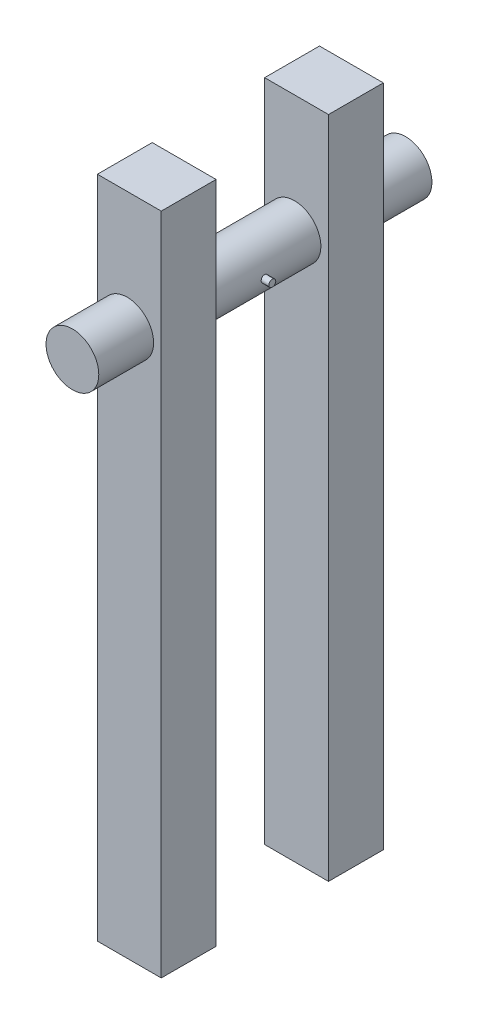
from build123d import *

# Parameters (mm, degrees)
SKETCH1_W                = 7.9
SKETCH1_H                = 95.7
BOSS_EXTRUDE1_DEPTH      = 9.2
SKETCH1_3_W              = 7.9
SKETCH1_3_H              = 95.7
BOSS_EXTRUDE2_DEPTH      = 9.2
BOSS_EXTRUDE3_DEPTH      = 32
BOSS_EXTRUDE3_DEPTH_BACK = 16
SKETCH2_R                = 3.8
BOSS_EXTRUDE4_DEPTH      = 0.0001
BOSS_EXTRUDE4_DEPTH_BACK = 6
SKETCH4_R                = 0.5


with BuildPart() as part:
    # Sketch1 → Boss-Extrude1 (new body)
    with BuildSketch(Plane(origin=(0, 0, 0), x_dir=(0, 0, -1), z_dir=(1, 0, 0))):
        with Locations((-28.171698113, -0.670754717)):
            Rectangle(SKETCH1_W, SKETCH1_H)
    extrude(amount=BOSS_EXTRUDE1_DEPTH)

    # Sketch1<3> → Boss-Extrude2 (add)
    with BuildSketch(Plane(origin=(0, 0, 0), x_dir=(0, 0, -1), z_dir=(1, 0, 0))):
        with Locations((-28.171698113, -0.670754717)):
            Rectangle(SKETCH1_3_W, SKETCH1_3_H)
        with Locations((-4.071698113, -0.670754717)):
            Rectangle(SKETCH1_3_W, SKETCH1_3_H)
    extrude(amount=BOSS_EXTRUDE2_DEPTH)


with BuildPart() as boss_extrude2_piece_1:
    # of the separate pieces the step leaves, piece 1, a body of its own (boss_extrude2_pieces)
    add(part.part.solids().sort_by_distance((0, 47.179245283, 8.021698113))[0])



with BuildPart() as boss_extrude2_piece_2:
    # of the separate pieces the step leaves, piece 2, a body of its own (boss_extrude2_pieces)
    add(part.part.solids().sort_by_distance((0, 47.179245283, 32.121698113))[0])


with BuildPart() as boss_extrude2_piece_1_1:
    add(boss_extrude2_piece_1.part)

    add(boss_extrude2_piece_2.part)  # Boss-Extrude3 merges Boss-Extrude2 piece 2
    # Sketch2 → Boss-Extrude3 (add, two sides: drawn at the far end of the back side and taken through both)
    with BuildSketch(Plane.XY.offset(8.021698113).offset(-BOSS_EXTRUDE3_DEPTH_BACK)):
        with Locations((4.3, 30.179245283)):
            Circle(SKETCH2_R)
    extrude(amount=BOSS_EXTRUDE3_DEPTH + BOSS_EXTRUDE3_DEPTH_BACK)

    # Sketch4 → Boss-Extrude4 (add, two sides: drawn at the far end of the back side and taken through both)
    with BuildSketch(Plane(origin=(9.2, 0, 0), x_dir=(0, 0, -1), z_dir=(1, 0, 0)).offset(-BOSS_EXTRUDE4_DEPTH_BACK)):
        with Locations((-16.121698113, 30.179245283)):
            Circle(SKETCH4_R)
    extrude(amount=BOSS_EXTRUDE4_DEPTH + BOSS_EXTRUDE4_DEPTH_BACK)


solid = boss_extrude2_piece_1_1.part
